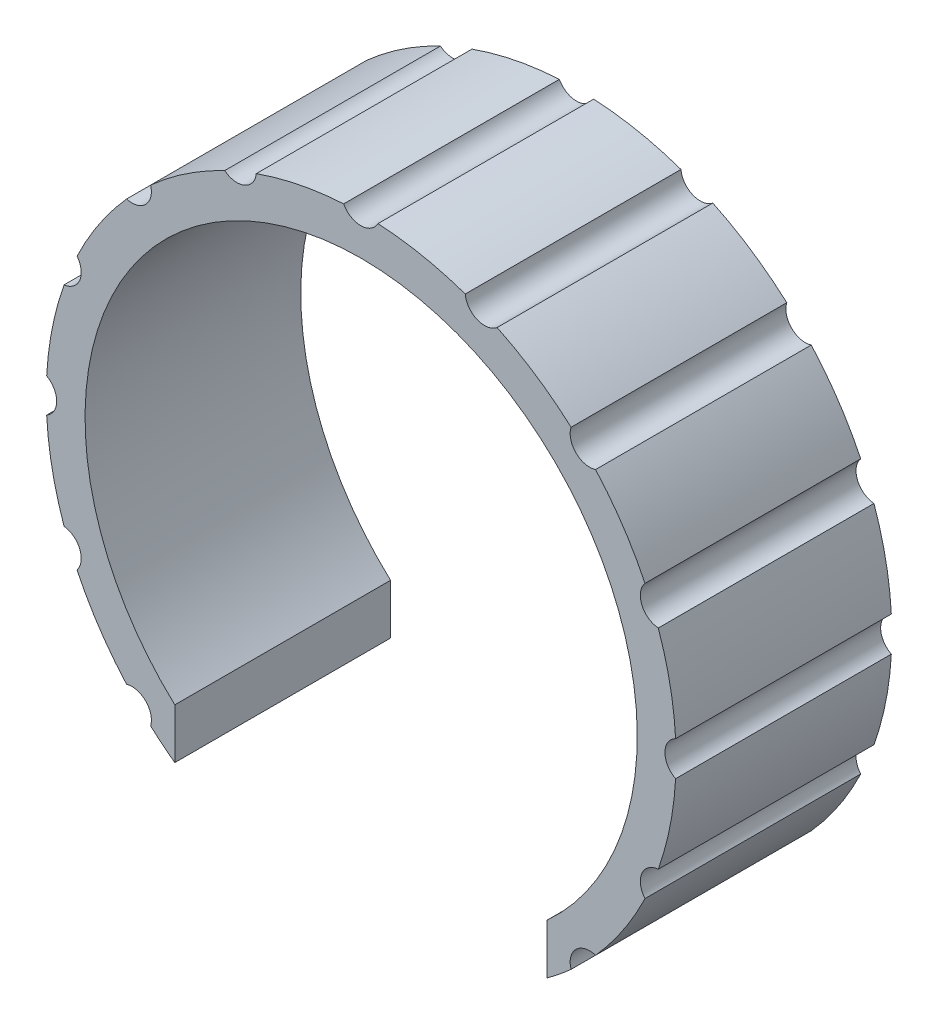
from build123d import *

# Parameters (mm, degrees)
SKETCH3_W               = 140.131000148
SKETCH3_H               = 140
BOSS_EXTRUDE3_DEPTH     = 30
SKETCH3_7_OUTSIDE_W     = 182.199
SKETCH3_7_OUTSIDE_H     = 182.068
SKETCH3_7_OUTSIDE_W_2   = 140.131000148
SKETCH3_7_OUTSIDE_H_2   = 140
SKETCH3_7_OUTSIDE_R     = 32
CUT_EXTRUDE5_DEPTH      = 35
CUT_EXTRUDE6_DEPTH      = 10
CUT_EXTRUDE6_DEPTH_BACK = 5
SKETCH2_R               = 2.25
CUT_EXTRUDE8_DEPTH      = 207.479750358
CUT_EXTRUDE8_DEPTH_BACK = 207.479750358
SKETCH4_OUTSIDE_W       = 182.199
SKETCH4_OUTSIDE_H       = 182.068
SKETCH4_OUTSIDE_R       = 42.5
SKETCH5_OUTSIDE_W       = 111.78
SKETCH5_OUTSIDE_H       = 111.78
SKETCH5_OUTSIDE_R       = 36.5
CUT_EXTRUDE9_DEPTH      = 25
SKETCH2_3_R             = 2.25
CUT_EXTRUDE10_DEPTH     = 30
CUT_EXTRUDE14_DEPTH     = 25
SKETCH16_R              = 42.5
CUT_EXTRUDE15_DEPTH     = 5


with BuildPart() as part:
    # Sketch3 → Boss-Extrude3 (new body)
    with BuildSketch(Plane.XY):
        with Locations((-121.856065437, 0)):
            Rectangle(SKETCH3_W, SKETCH3_H)
    extrude(amount=BOSS_EXTRUDE3_DEPTH)

    # Sketch3<7> outside → Cut-Extrude5 (cut)
    # profile 1 of 2: a face of its own
    with BuildSketch(Plane.XY):
        with Locations((-121.8565, 0)):
            Rectangle(SKETCH3_7_OUTSIDE_W, SKETCH3_7_OUTSIDE_H)
        with Locations((-121.856065437, 0)):
            Rectangle(SKETCH3_7_OUTSIDE_W_2, SKETCH3_7_OUTSIDE_H_2, mode=Mode.SUBTRACT)
    # profile 2 of 2: a face of its own
    with BuildSketch(Plane.XY):
        with Locations((-121.856065437, 0)):
            Circle(SKETCH3_7_OUTSIDE_R)
    extrude(amount=CUT_EXTRUDE5_DEPTH, mode=Mode.SUBTRACT)

    # Sketch2 → Cut-Extrude6 (cut, two sides: drawn at the far end of the back side and taken through both)
    with BuildSketch(Plane.XY.offset(-CUT_EXTRUDE6_DEPTH_BACK)):
        with Locations((-107.548664291, 34.645482469)):
            Circle(SKETCH2_R)
        with Locations((-95.38278871, 26.516504294)):
            Circle(SKETCH2_R)
        with Locations((-87.253810535, 14.350628714)):
            Circle(SKETCH2_R)
        with Locations((-84.399293004, 0)):
            Circle(SKETCH2_R)
        with Locations((-87.253810535, -14.350628714)):
            Circle(SKETCH2_R)
        with Locations((-95.38278871, -26.516504294)):
            Circle(SKETCH2_R)
        with Locations((-107.548664291, -34.645482469)):
            Circle(SKETCH2_R)
        with Locations((-121.899293004, -37.5)):
            Circle(SKETCH2_R)
        with Locations((-136.249921718, -34.645482469)):
            Circle(SKETCH2_R)
        with Locations((-148.415797299, -26.516504294)):
            Circle(SKETCH2_R)
        with Locations((-156.544775474, -14.350628714)):
            Circle(SKETCH2_R)
        with Locations((-159.399293004, 0)):
            Circle(SKETCH2_R)
        with Locations((-156.544775474, 14.350628714)):
            Circle(SKETCH2_R)
        with Locations((-148.415797299, 26.516504294)):
            Circle(SKETCH2_R)
        with Locations((-136.249921718, 34.645482469)):
            Circle(SKETCH2_R)
        with Locations((-121.899293004, 37.5)):
            Circle(SKETCH2_R)
    extrude(amount=CUT_EXTRUDE6_DEPTH + CUT_EXTRUDE6_DEPTH_BACK, mode=Mode.SUBTRACT)

    # Sketch4 outside → Cut-Extrude8 (cut, two sides: drawn at the far end of the back side and taken through both)
    with BuildSketch(Plane.XY.offset(30).offset(-CUT_EXTRUDE8_DEPTH_BACK)):
        with Locations((-121.8565, 0)):
            Rectangle(SKETCH4_OUTSIDE_W, SKETCH4_OUTSIDE_H)
        with Locations((-121.856065437, 0)):
            Circle(SKETCH4_OUTSIDE_R, mode=Mode.SUBTRACT)
    extrude(amount=CUT_EXTRUDE8_DEPTH + CUT_EXTRUDE8_DEPTH_BACK, mode=Mode.SUBTRACT)

    # Sketch5 outside → Cut-Extrude9 (cut)
    with BuildSketch(Plane.XY.offset(30)):
        with Locations((-121.856, 0)):
            Rectangle(SKETCH5_OUTSIDE_W, SKETCH5_OUTSIDE_H)
        with Locations((-121.856065437, 0)):
            Circle(SKETCH5_OUTSIDE_R, mode=Mode.SUBTRACT)
    extrude(amount=-CUT_EXTRUDE9_DEPTH, mode=Mode.SUBTRACT)

    # Sketch2<3> → Cut-Extrude10 (cut)
    with BuildSketch(Plane.XY):
        with Locations((-107.548664291, 34.645482469)):
            Circle(SKETCH2_3_R)
        with Locations((-95.38278871, 26.516504294)):
            Circle(SKETCH2_3_R)
        with Locations((-87.253810535, 14.350628714)):
            Circle(SKETCH2_3_R)
        with Locations((-84.399293004, 0)):
            Circle(SKETCH2_3_R)
        with Locations((-87.253810535, -14.350628714)):
            Circle(SKETCH2_3_R)
        with Locations((-95.38278871, -26.516504294)):
            Circle(SKETCH2_3_R)
        with Locations((-107.548664291, -34.645482469)):
            Circle(SKETCH2_3_R)
        with Locations((-121.899293004, -37.5)):
            Circle(SKETCH2_3_R)
        with Locations((-136.249921718, -34.645482469)):
            Circle(SKETCH2_3_R)
        with Locations((-148.415797299, -26.516504294)):
            Circle(SKETCH2_3_R)
        with Locations((-156.544775474, -14.350628714)):
            Circle(SKETCH2_3_R)
        with Locations((-159.399293004, 0)):
            Circle(SKETCH2_3_R)
        with Locations((-156.544775474, 14.350628714)):
            Circle(SKETCH2_3_R)
        with Locations((-148.415797299, 26.516504294)):
            Circle(SKETCH2_3_R)
        with Locations((-136.249921718, 34.645482469)):
            Circle(SKETCH2_3_R)
        with Locations((-121.899293004, 37.5)):
            Circle(SKETCH2_3_R)
    extrude(amount=CUT_EXTRUDE10_DEPTH, mode=Mode.SUBTRACT)

    # Sketch15 → Cut-Extrude14 (cut)
    with BuildSketch(Plane.XY.offset(30)):
        with BuildLine():
            Line((-143.464225434, -37.475141345), (-143.420997866, 0.024858655))
            ThreePointArc((-143.420997866, 0.024858655), (-121.831206782, 21.564932429), (-100.291133008, -0.024858655))
            Line((-100.291133008, -0.024858655), (-100.334360575, -37.524858655))
            ThreePointArc((-100.334360575, -37.524858655), (-121.92415166, -59.064932429), (-143.464225434, -37.475141345))
        make_face()
    extrude(amount=-CUT_EXTRUDE14_DEPTH, mode=Mode.SUBTRACT)

    # Sketch16 → Cut-Extrude15 (cut)
    with BuildSketch(Plane(origin=(0, 0, 0), x_dir=(-1, 0, 0), z_dir=(0, 0, -1))):
        with Locations((121.856065437, 0)):
            Circle(SKETCH16_R)
    extrude(amount=-CUT_EXTRUDE15_DEPTH, mode=Mode.SUBTRACT)


solid = part.part
